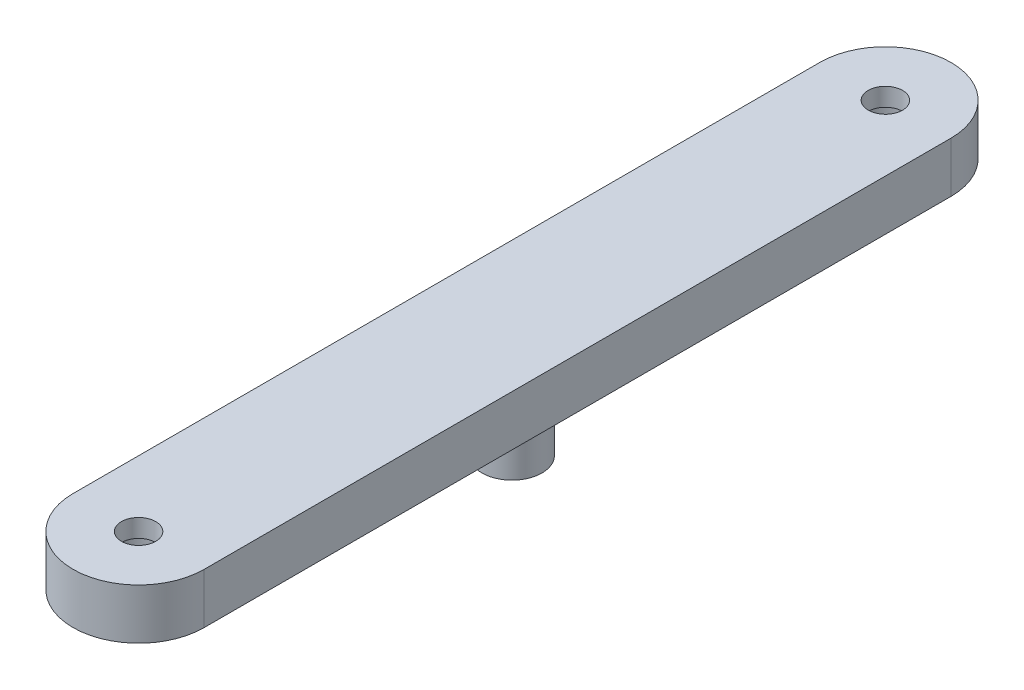
from build123d import *

# Parameters (mm, degrees)
BARRA_START       = -44.75
SK_BARRA_W        = 13
SK_BARRA_H        = 74
BARRA_DEPTH       = 5
EXTREMOS_START    = -44.75
SK_EXTREMOS_R     = 6.5
EXTREMOS_DEPTH    = 5
PERNO_696_START   = -51.75
SK_PERNO_696_R    = 2.975
PERNO_696_DEPTH   = 7
PASANTES_M3_START = -44.75
SK_PASANTES_M3_R  = 1.7
PASANTES_M3_DEPTH = 5
CAJAS_M3_START    = -44.75
SK_CAJAS_M3_R     = 3
CAJAS_M3_DEPTH    = 3.2


with BuildPart() as part:
    # Sk_Barra → Barra (new body)
    with BuildSketch(Plane(origin=(0, 0, 0), x_dir=(1, 0, 0), z_dir=(0, 1, 0)).offset(BARRA_START)):
        with Locations((0, -170)):
            Rectangle(SK_BARRA_W, SK_BARRA_H)
    extrude(amount=BARRA_DEPTH)

    # Sk_Extremos → Extremos (add)
    with BuildSketch(Plane(origin=(0, 0, 0), x_dir=(1, 0, 0), z_dir=(0, 1, 0)).offset(EXTREMOS_START)):
        with Locations((0, -133)):
            Circle(SK_EXTREMOS_R)
        with Locations((0, -207)):
            Circle(SK_EXTREMOS_R)
    extrude(amount=EXTREMOS_DEPTH)

    # Sk_Perno_696 → Perno_696 (add)
    with BuildSketch(Plane(origin=(0, 0, 0), x_dir=(1, 0, 0), z_dir=(0, 1, 0)).offset(PERNO_696_START)):
        with Locations(Location((0, -170, 0), (0, 0, 270))):
            Circle(SK_PERNO_696_R)
    extrude(amount=PERNO_696_DEPTH)

    # Sk_Pasantes_M3 → Pasantes_M3 (cut)
    with BuildSketch(Plane(origin=(0, 0, 0), x_dir=(1, 0, 0), z_dir=(0, 1, 0)).offset(PASANTES_M3_START)):
        with Locations(Location((0, -133, 0), (0, 0, 270))):
            Circle(SK_PASANTES_M3_R)
        with Locations(Location((0, -207, 0), (0, 0, 270))):
            Circle(SK_PASANTES_M3_R)
    extrude(amount=PASANTES_M3_DEPTH, mode=Mode.SUBTRACT)

    # Sk_Cajas_M3 → Cajas_M3 (cut)
    with BuildSketch(Plane(origin=(0, 0, 0), x_dir=(1, 0, 0), z_dir=(0, 1, 0)).offset(CAJAS_M3_START)):
        with Locations(Location((0, -133, 0), (0, 0, 270))):
            Circle(SK_CAJAS_M3_R)
        with Locations(Location((0, -207, 0), (0, 0, 270))):
            Circle(SK_CAJAS_M3_R)
    extrude(amount=CAJAS_M3_DEPTH, mode=Mode.SUBTRACT)


solid = part.part
